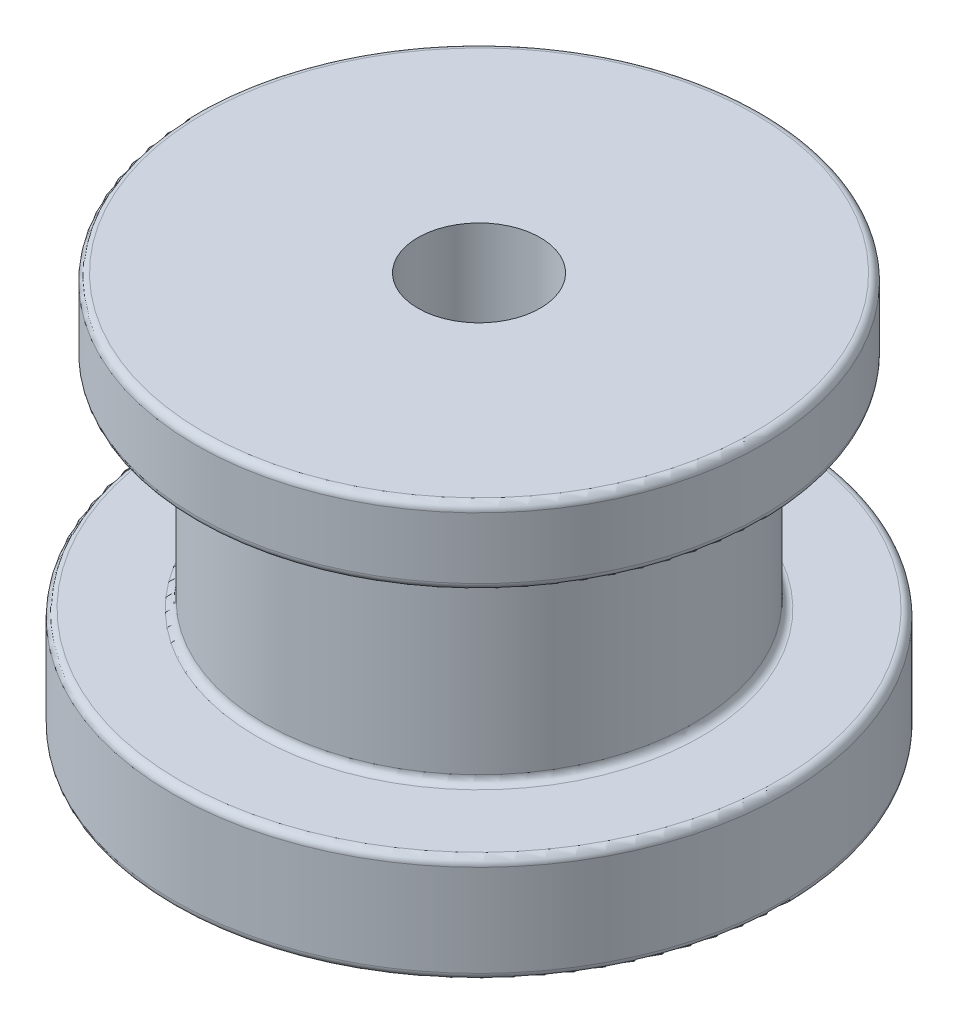
from build123d import *


with BuildPart() as part:
    # Sketch2 → Revolve1 (revolve)
    with BuildSketch(Plane(origin=(0, 0, 0), x_dir=(0, 0, -1), z_dir=(1, 0, 0)), mode=Mode.PRIVATE) as revolve1_sk:
        with BuildLine():
            Line((4, -13), (19.5, -13))
            ThreePointArc((19.5, -13), (19.853553391, -12.853553391), (20, -12.5))
            Line((20, -12.5), (20, -6.5))
            ThreePointArc((20, -6.5), (19.853553391, -6.146446609), (19.5, -6))
            Line((19.5, -6), (14.5, -6))
            ThreePointArc((14.5, -6), (14.146446609, -5.853553391), (14, -5.5))
            Line((14, -5.5), (14, 7.5))
            ThreePointArc((14, 7.5), (14.146446609, 7.853553391), (14.5, 8))
            Line((14.5, 8), (18, 8))
            ThreePointArc((18, 8), (18.353553391, 8.146446609), (18.5, 8.5))
            Line((18.5, 8.5), (18.5, 12.5))
            ThreePointArc((18.5, 12.5), (18.353553391, 12.853553391), (18, 13))
            Line((18, 13), (4, 13))
            Line((4, 13), (4, -13))
        make_face()
    revolve(revolve1_sk.sketch.rotate(Axis((0, 13, 0), (0, -1, 0)), 180), axis=Axis((0, 13, 0), (0, -1, 0)))


solid = part.part
